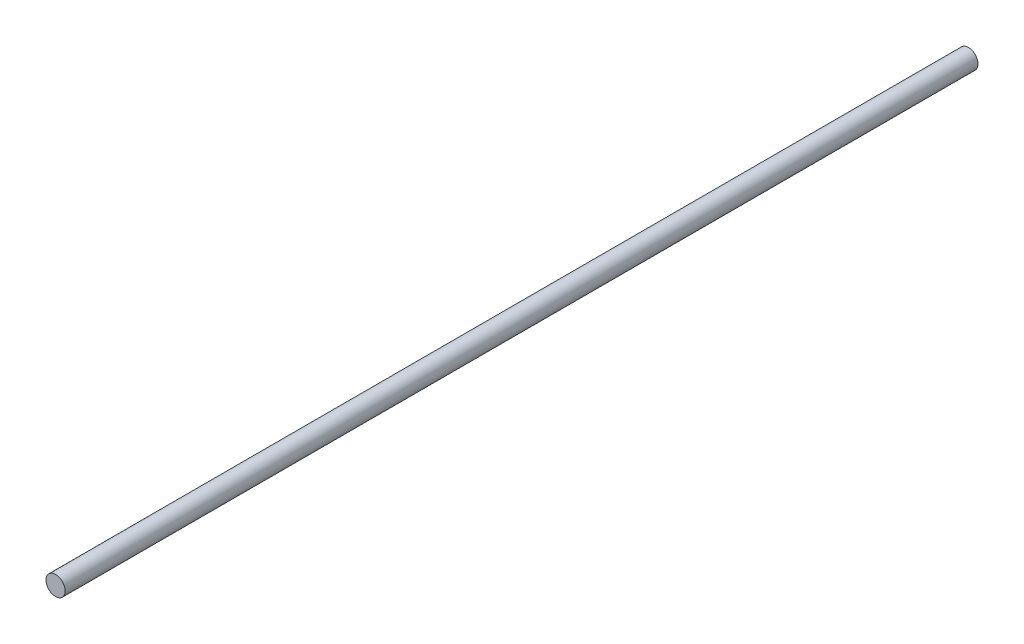
from build123d import *

# Parameters (mm, degrees)
SKETCH1_R           = 3.15
BOSS_EXTRUDE1_DEPTH = 300


with BuildPart() as part:
    # Sketch1 → Boss-Extrude1 (new body)
    with BuildSketch(Plane.XY):
        with Locations((-1.240327924, -1.130887225)):
            Circle(SKETCH1_R)
    extrude(amount=BOSS_EXTRUDE1_DEPTH)


solid = part.part
